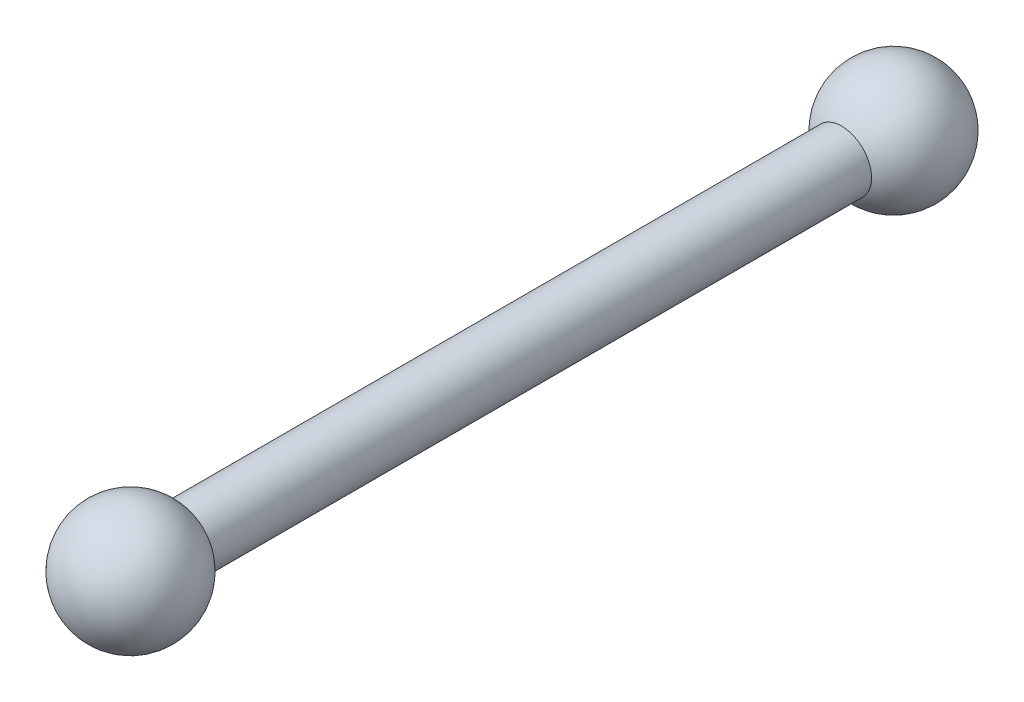
from build123d import *

# Parameters (mm, degrees)
SKETCH1_R           = 2
BOSS_EXTRUDE1_DEPTH = 45


with BuildPart() as part:
    # Sketch1 → Boss-Extrude1 (new body)
    with BuildSketch(Plane.XY):
        Circle(SKETCH1_R)
    extrude(amount=-BOSS_EXTRUDE1_DEPTH)

    # Sketch2 → Revolve1 (revolve)
    with BuildSketch(Plane.XY.offset(3)):
        with BuildLine():
            Line((0, 4), (0, -4))
            ThreePointArc((0, -4), (4, 0), (0, 4))
        make_face()
    revolve1 = revolve(axis=Axis((0, 4, 3), (0, -1, 0)))

    # Mirror2: Revolve1 across plane
    add(revolve1.mirror(Plane.XY.offset(-22.5)))


solid = part.part
